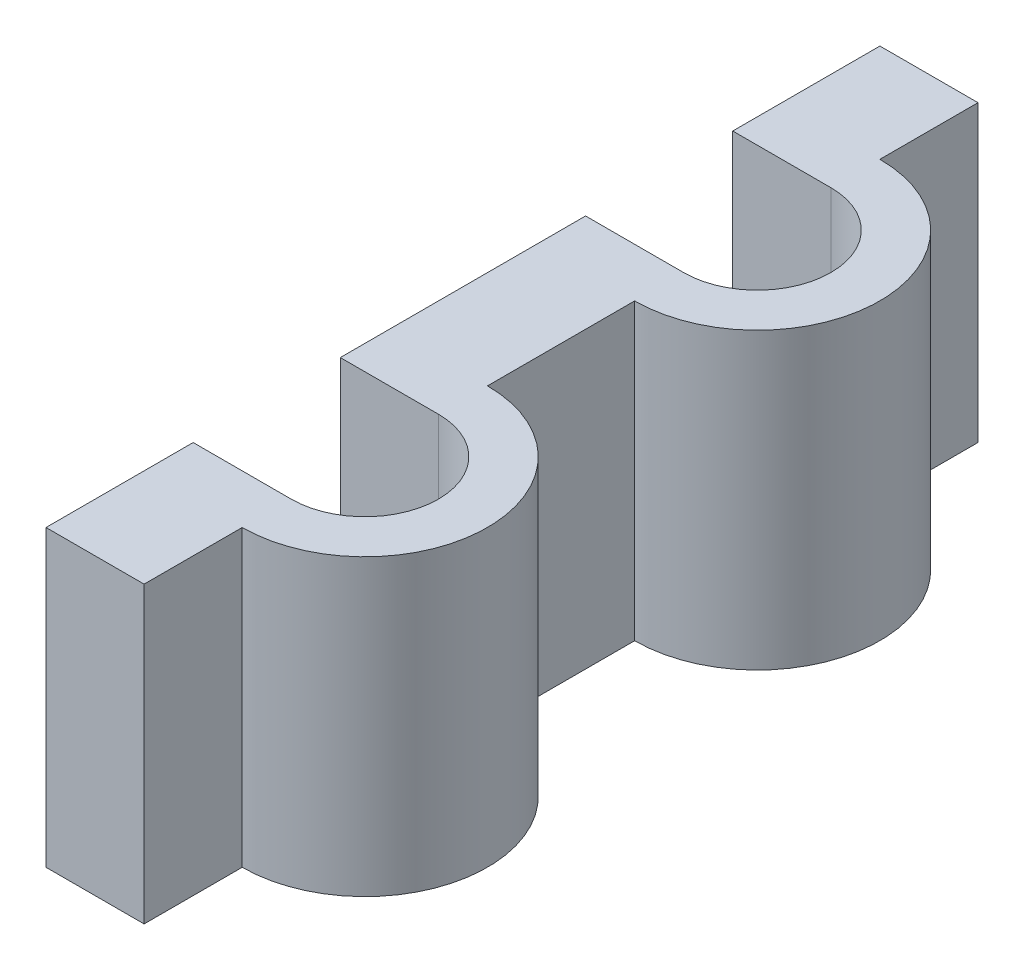
from build123d import *

# Parameters (mm, degrees)
BOSS_EXTRUDE1_DEPTH = 30


with BuildPart() as part:
    # Sketch2 → Boss-Extrude1 (new body)
    with BuildSketch(Plane(origin=(0, 0, 0), x_dir=(1, 0, 0), z_dir=(0, 1, 0))):
        with BuildLine():
            Line((0, 0), (0, 15))
            Line((0, 15), (9.999999101, 15))
            ThreePointArc((9.999999101, 15), (17.5, 22.5), (9.999999101, 30))
            Line((9.999999101, 30), (0, 30))
            Line((0, 30), (0, 55))
            Line((0, 55), (9.999999101, 55))
            ThreePointArc((9.999999101, 55), (17.5, 62.5), (9.999999101, 70))
            Line((9.999999101, 70), (0, 70))
            Line((0, 70), (0, 85))
            Line((0, 85), (10, 85))
            Line((10, 85), (10, 75))
            ThreePointArc((10, 75), (22.5, 62.5), (10, 50))
            Line((10, 50), (10, 35))
            ThreePointArc((10, 35), (22.5, 22.5), (10, 10))
            Line((10, 10), (10, 0))
            Line((10, 0), (0, 0))
        make_face()
    extrude(amount=BOSS_EXTRUDE1_DEPTH)


solid = part.part
